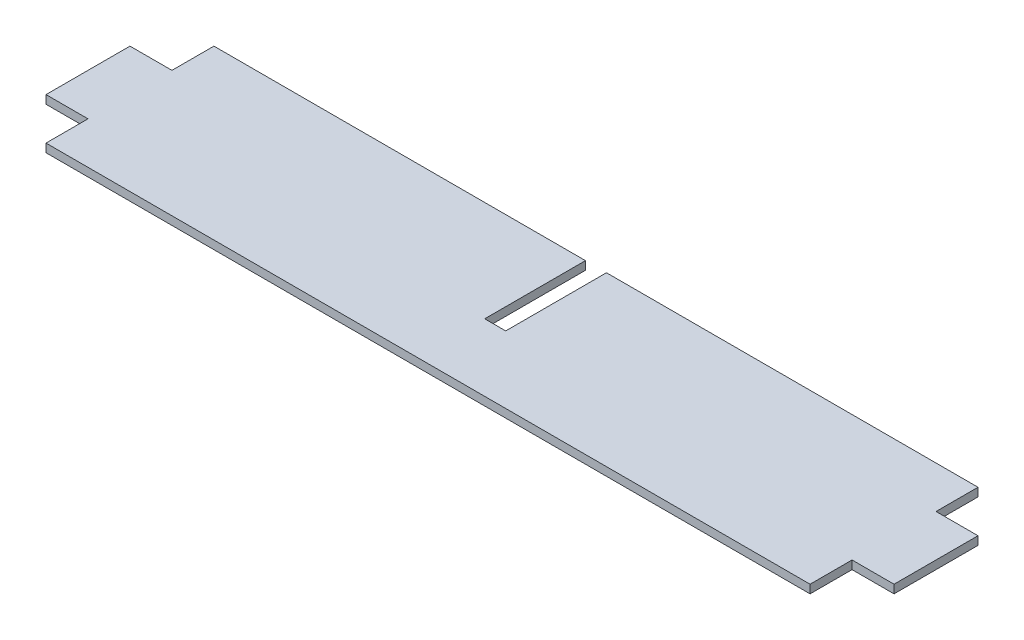
from build123d import *

# Parameters (mm, degrees)
SKETCH1_W               = 1010
SKETCH1_H               = 200
BOSS_EXTRUDE1_DEPTH     = 10
SKETCH2_W               = 50
SKETCH2_H               = 50
CUT_EXTRUDE1_DEPTH      = 10
MIRROR2_COPY_1_SKETCH_W = 50
MIRROR2_COPY_1_SKETCH_H = 50
MIRROR2_COPY_1_DEPTH    = 10
SKETCH3_W               = 25
SKETCH3_H               = 120
CUT_EXTRUDE3_DEPTH      = 10


with BuildPart() as part:
    # Sketch1 → Boss-Extrude1 (new body)
    with BuildSketch(Plane(origin=(0, 0, 0), x_dir=(1, 0, 0), z_dir=(0, 1, 0))):
        Rectangle(SKETCH1_W, SKETCH1_H)
    extrude(amount=BOSS_EXTRUDE1_DEPTH)

    # Sketch2 → Cut-Extrude1 (cut)
    with BuildSketch(Plane(origin=(0, 10, 0), x_dir=(1, 0, 0), z_dir=(0, 1, 0))):
        with Locations((-480, 75)):
            Rectangle(SKETCH2_W, SKETCH2_H)
    cut_extrude1 = extrude(amount=-CUT_EXTRUDE1_DEPTH, mode=Mode.SUBTRACT)

    # Mirror1: Cut-Extrude1 across plane
    add(cut_extrude1.mirror(Plane.XY), mode=Mode.SUBTRACT)

    # Mirror2: Cut-Extrude1 across plane
    add(cut_extrude1.mirror(Plane(origin=(0, 0, 0), x_dir=(0, 0, 1), z_dir=(1, 0, 0))), mode=Mode.SUBTRACT)

    # Mirror2 copy 1 sketch → Mirror2 copy 1 (cut)
    with BuildSketch(Plane(origin=(0, 10, 0), x_dir=(-1, 0, 0), z_dir=(0, 1, 0))):
        with Locations((-480, 75)):
            Rectangle(MIRROR2_COPY_1_SKETCH_W, MIRROR2_COPY_1_SKETCH_H)
    extrude(amount=-MIRROR2_COPY_1_DEPTH, mode=Mode.SUBTRACT)

    # Sketch3 → Cut-Extrude3 (cut)
    with BuildSketch(Plane(origin=(0, 0, 0), x_dir=(1, 0, 0), z_dir=(0, 1, 0))):
        with Locations((0, 40)):
            Rectangle(SKETCH3_W, SKETCH3_H)
    extrude(amount=CUT_EXTRUDE3_DEPTH, mode=Mode.SUBTRACT)


solid = part.part
